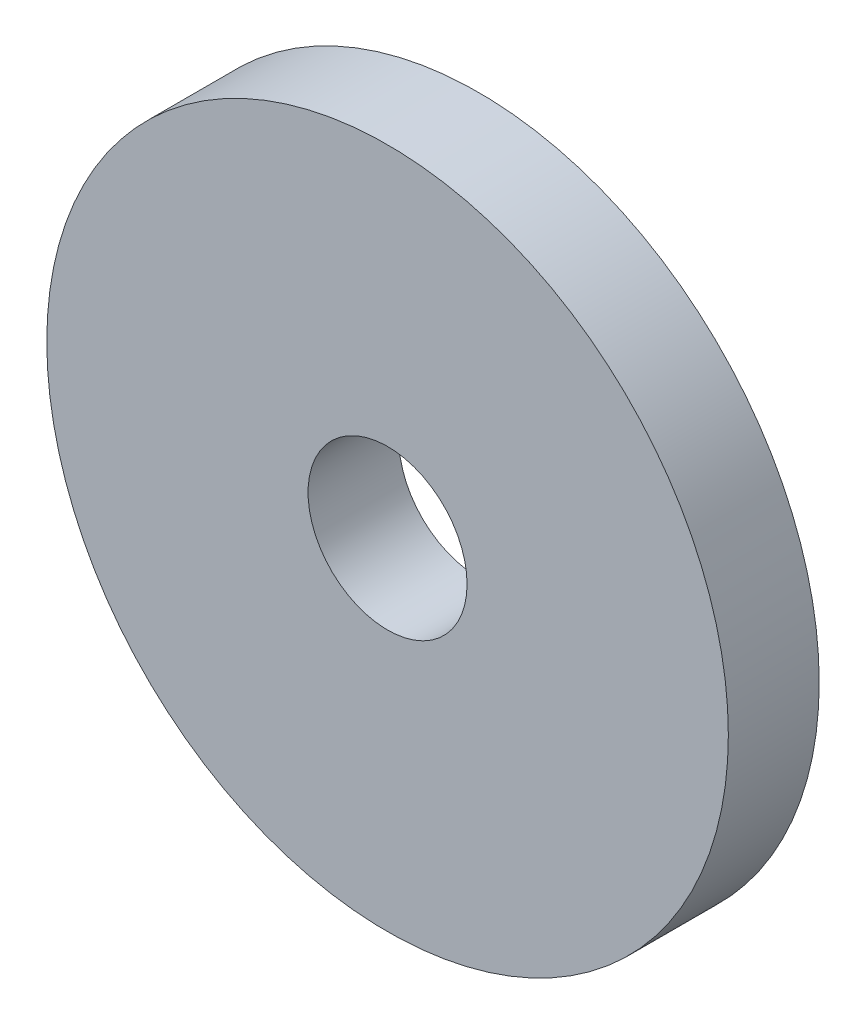
from build123d import *

# Parameters (mm, degrees)
ESBO_O1_R                = 7.5
ESBO_O1_R_2              = 1.75
RESSALTO_EXTRUS_O1_DEPTH = 2


with BuildPart() as part:
    # Esboço1 → Ressalto-extrusão1 (new body)
    with BuildSketch(Plane.XY):
        Circle(ESBO_O1_R)
        Circle(ESBO_O1_R_2, mode=Mode.SUBTRACT)
    extrude(amount=RESSALTO_EXTRUS_O1_DEPTH)


solid = part.part
